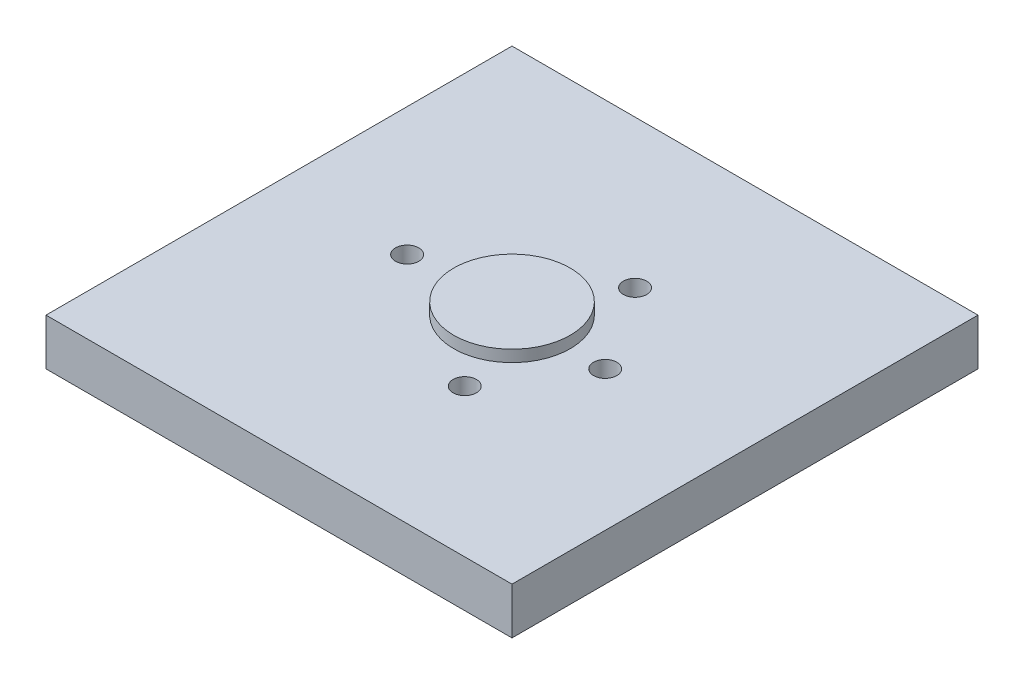
from build123d import *

# Parameters (mm, degrees)
SKETCH1_W                   = 127
SKETCH1_H                   = 127
BOSS_EXTRUDE1_DEPTH         = 12.7
SKETCH3_R                   = 15.875
BOSS_EXTRUDE2_DEPTH         = 3.175
F_1_4_0_25_DIAMETER_HOLE1_D = 6.35
F_1_4_0_25_DIAMETER_HOLE2_D = 6.35


with BuildPart() as part:
    # Sketch1 → Boss-Extrude1 (new body)
    with BuildSketch(Plane(origin=(0, 0, 0), x_dir=(1, 0, 0), z_dir=(0, 1, 0))):
        Rectangle(SKETCH1_W, SKETCH1_H)
    extrude(amount=BOSS_EXTRUDE1_DEPTH)

    # Sketch3 → Boss-Extrude2 (add)
    with BuildSketch(Plane(origin=(0, 12.7, 0), x_dir=(1, 0, 0), z_dir=(0, 1, 0))):
        with Locations(Location((0, 0, 0), (0, 0, 270))):
            Circle(SKETCH3_R)
    extrude(amount=BOSS_EXTRUDE2_DEPTH)

    # 1/4 (0.25) Diameter Hole1 (through all)
    with Locations(Plane(origin=(0, 12.7, 0), x_dir=(1, 0, 0), z_dir=(0, 1, 0))):
        with Locations((10.331110734, 23.204054624), (25.4, 0), (10.331110734, -23.204054624)):
            Hole(F_1_4_0_25_DIAMETER_HOLE1_D / 2)

    # 1/4 (0.25) Diameter Hole2 (through all)
    with Locations(Plane(origin=(0, 12.7, 0), x_dir=(1, 0, 0), z_dir=(0, 1, 0))):
        with Locations((-28.575, 0)):
            Hole(F_1_4_0_25_DIAMETER_HOLE2_D / 2)


solid = part.part
